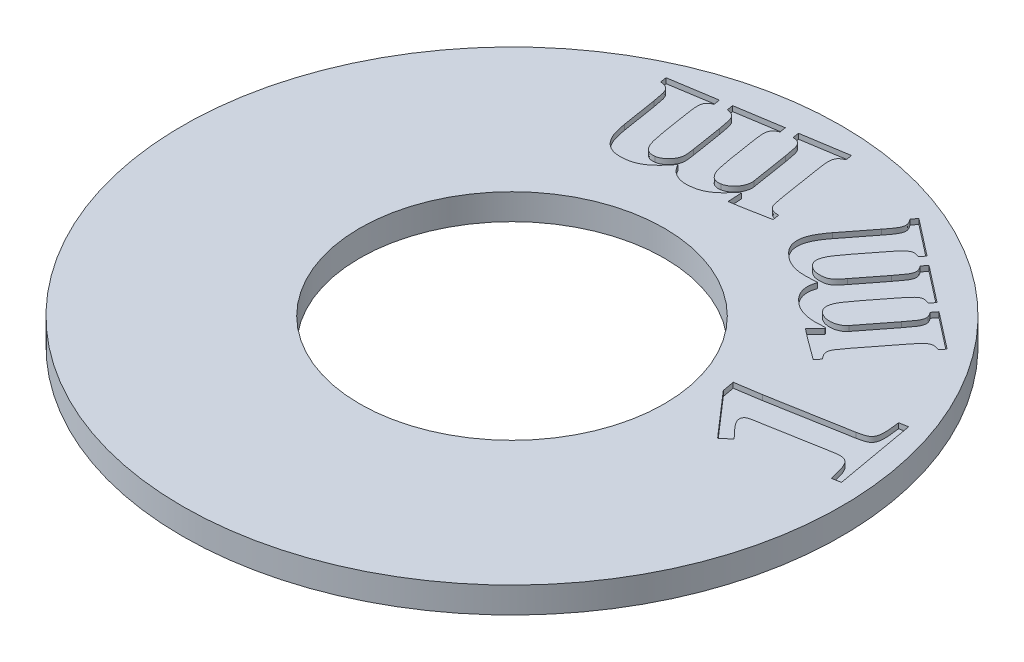
from build123d import *

# Parameters (mm, degrees)
SKETCH1_R           = 12.7
BOSS_EXTRUDE1_DEPTH = 1
SKETCH2_R           = 5.8674
CUT_EXTRUDE1_DEPTH  = 18.98832955
CUT_EXTRUDE2_DEPTH  = 0.2


with BuildPart() as part:
    # Sketch1 → Boss-Extrude1 (new body)
    with BuildSketch(Plane(origin=(0, 0, 0), x_dir=(1, 0, 0), z_dir=(0, 1, 0))):
        with Locations(Location((0, 0, 0), (0, 0, 270))):
            Circle(SKETCH1_R)
    extrude(amount=BOSS_EXTRUDE1_DEPTH)

    # Sketch2 → Cut-Extrude1 (cut, through all)
    with BuildSketch(Plane(origin=(0, 0, 0), x_dir=(-1, 0, 0), z_dir=(0, -1, 0))):
        with Locations(Location((0, 0, 0), (0, 0, 90))):
            Circle(SKETCH2_R)
    extrude(amount=-CUT_EXTRUDE1_DEPTH, mode=Mode.SUBTRACT)

    # Sketch4 → Cut-Extrude2 (cut)
    with BuildSketch(Plane(origin=(0, 1, 0), x_dir=(1, 0, 0), z_dir=(0, 1, 0))):
        with BuildLine():
            add(Edge.make_bspline(
                [(10.502835701, 2.747256944), (10.535958787, 2.753635056), (10.597619367, 2.765508288), (10.68289299, 2.785497337), (10.754934333, 2.804751749), (10.83115688, 2.831434792), (10.908616374, 2.872710013), (10.983063242, 2.939891348), (11.031547566, 3.030268528), (11.057288986, 3.142661226), (11.066935793, 3.278500029), (11.06128653, 3.408848056), (11.053268397, 3.529765111), (11.041774037, 3.63744486), (11.026137193, 3.758286119), (11.014089218, 3.843452977), (11.007748896, 3.888272569)],
                knots=[0, 0, 0, 0, 0.95120931, 1.770732274, 2.469728581, 3.053236218, 4.045778316, 4.92566005, 5.839669914, 6.887844203, 8.156461987, 9.670137205, 10.563586198, 11.574197932, 12.723406461, 14, 14, 14, 14], degree=3))
            Line((11.007748896, 3.888272569), (11.339580493, 3.947803819))
            Line((11.339580493, 3.947803819), (11.900717646, 0.795954861))
            Line((11.900717646, 0.795954861), (11.568886048, 0.736423611))
            add(Edge.make_bspline(
                [(11.568886048, 0.736423611), (11.554803043, 0.798585514), (11.528746521, 0.913598105), (11.489384912, 1.071011026), (11.453602851, 1.199155265), (11.419912183, 1.300799564), (11.386730997, 1.382540059), (11.35336047, 1.450924625), (11.316835265, 1.508004968), (11.277656715, 1.55458428), (11.234590877, 1.59165404), (11.187644786, 1.62258404), (11.134361285, 1.64406377), (11.074344364, 1.659243306), (11.003086635, 1.66500658), (10.917056963, 1.663740947), (10.814442972, 1.651454292), (10.740904843, 1.639267459), (10.701273201, 1.632699653)],
                knots=[0, 0, 0, 0, 2.063073641, 3.817120061, 5.251678484, 6.368851115, 7.281122152, 8.10565521, 8.828216282, 9.469439415, 10.068097664, 10.662010233, 11.280545861, 11.918117793, 12.659047895, 13.586927584, 14.699531502, 16, 16, 16, 16], degree=3))
            Line((10.701273201, 1.632699653), (8.060952021, 1.163064236))
            add(Edge.make_bspline(
                [(8.060952021, 1.163064236), (8.037667348, 1.158078091), (7.994477264, 1.148829432), (7.936130638, 1.128346498), (7.889333412, 1.101785371), (7.854520705, 1.069466258), (7.829800128, 1.032851206), (7.817133941, 0.991590699), (7.810708439, 0.947006345), (7.815062759, 0.916476287), (7.817314868, 0.900685764)],
                knots=[0, 0, 0, 0, 1.400993529, 2.598663486, 3.626413984, 4.544745121, 5.372764933, 6.19368933, 7.065753812, 8, 8, 8, 8], degree=3))
            add(Edge.make_bspline(
                [(7.817314868, 0.900685764), (7.821529308, 0.883943745), (7.830815176, 0.847055295), (7.859831933, 0.790796719), (7.896481283, 0.725393275), (7.938756081, 0.667449744), (7.979789109, 0.614975147), (8.018534287, 0.568769553), (8.063746687, 0.516951587), (8.115980512, 0.459628299), (8.174041538, 0.395714584), (8.239200773, 0.326359636), (8.310840637, 0.251371205), (8.361130158, 0.199858655), (8.387271465, 0.173081597)],
                knots=[0, 0, 0, 0, 0.664509197, 1.464143271, 2.430196891, 3.559892813, 4.226820614, 5.002434619, 5.887259823, 6.881648262, 7.996278507, 9.220784234, 10.555318662, 12, 12, 12, 12], degree=3))
            Line((8.387271465, 0.173081597), (8.04000584, -0.117960069))
            Line((8.04000584, -0.117960069), (6.557236743, 1.585295139))
            Line((6.557236743, 1.585295139), (6.473452021, 2.052725694))
            add(Edge.make_bspline(
                [(6.473452021, 2.052725694), (6.504325495, 2.056351962), (6.569060101, 2.063955416), (6.670587219, 2.076897917), (6.780259537, 2.094127133), (6.898350755, 2.111263083), (7.024355019, 2.131394976), (7.158854817, 2.153428708), (7.301825046, 2.177571224), (7.399872247, 2.194875437), (7.450205493, 2.203758681)],
                knots=[0, 0, 0, 0, 0.754743075, 1.582523401, 2.484708457, 3.449980394, 4.479693127, 5.582710837, 6.759066988, 8, 8, 8, 8], degree=3))
            Line((7.450205493, 2.203758681), (10.502835701, 2.747256944))
        make_face()
        with BuildLine():
            Line((6.446112276, 5.621046804), (6.418551512, 5.656324582))
            add(Edge.make_bspline(
                [(6.418551512, 5.656324582), (6.345103003, 5.650481726), (6.205690041, 5.639391375), (6.006049673, 5.640001619), (5.827169527, 5.650699674), (5.666856777, 5.67597167), (5.521469939, 5.714933464), (5.387561193, 5.768451828), (5.261579098, 5.83414063), (5.185430088, 5.889090651), (5.147449081, 5.916498193)],
                knots=[0, 0, 0, 0, 1.328700104, 2.522011983, 3.598465663, 4.558669638, 5.444794913, 6.307777922, 7.155966722, 8, 8, 8, 8], degree=3))
            add(Edge.make_bspline(
                [(5.147449081, 5.916498193), (5.113549109, 5.943897718), (5.048106477, 5.996791479), (4.961452983, 6.081290035), (4.888569595, 6.165417061), (4.830459206, 6.250285271), (4.784446219, 6.336029232), (4.750511209, 6.423590405), (4.725338541, 6.51279674), (4.712276312, 6.605066622), (4.710185373, 6.700889708), (4.719470407, 6.800614492), (4.739279008, 6.904788894), (4.760550248, 6.974274273), (4.771520262, 7.010109304)],
                knots=[0, 0, 0, 0, 1.254723853, 2.422197594, 3.480533536, 4.455073735, 5.378270259, 6.276377898, 7.154433995, 8.041941717, 8.952311201, 9.908521309, 10.921381655, 12, 12, 12, 12], degree=3))
            add(Edge.make_bspline(
                [(4.771520262, 7.010109304), (4.691090698, 7.003656459), (4.538471998, 6.991411896), (4.321666343, 6.98846259), (4.129911724, 6.995416816), (3.960718577, 7.018564153), (3.808601542, 7.056299759), (3.667745769, 7.110172456), (3.535147857, 7.17881181), (3.454567942, 7.236924978), (3.414428248, 7.265873193)],
                knots=[0, 0, 0, 0, 1.366310217, 2.59263486, 3.670585393, 4.613332156, 5.479848919, 6.319088227, 7.162678639, 8, 8, 8, 8], degree=3))
            add(Edge.make_bspline(
                [(3.414428248, 7.265873193), (3.3775521, 7.295803428), (3.306764809, 7.353257376), (3.21306857, 7.444735382), (3.134735925, 7.535260481), (3.072420666, 7.626680072), (3.027114725, 7.721083516), (2.993029681, 7.816985205), (2.9748084, 7.916670154), (2.967827049, 8.01881721), (2.974809687, 8.124007378), (2.995095498, 8.231959079), (3.028806982, 8.342103336), (3.074329878, 8.45600405), (3.135236882, 8.572567121), (3.206795227, 8.695687314), (3.293019282, 8.822881794), (3.357079528, 8.907680315), (3.390174776, 8.951489512)],
                knots=[0, 0, 0, 0, 1.169264857, 2.244515684, 3.220319539, 4.113963992, 4.959955291, 5.792870505, 6.612950669, 7.447388896, 8.308923635, 9.201834464, 10.146760853, 11.141726431, 12.218423767, 13.382633535, 14.647798067, 16, 16, 16, 16], degree=3))
            Line((3.390174776, 8.951489512), (4.221407414, 10.019744721))
            add(Edge.make_bspline(
                [(4.221407414, 10.019744721), (4.253451667, 10.061583607), (4.315528507, 10.14263483), (4.402700621, 10.258852189), (4.474099835, 10.363054012), (4.52285553, 10.455601314), (4.552580969, 10.535251364), (4.563466398, 10.608503251), (4.558254548, 10.679867299), (4.53147758, 10.75154504), (4.489681708, 10.826689156), (4.454202161, 10.876320457), (4.435278942, 10.902791596)],
                knots=[0, 0, 0, 0, 1.558183804, 3.018548385, 4.296309646, 5.28770402, 6.105589718, 6.797073249, 7.462098622, 8.197436721, 9.038592567, 10, 10, 10, 10], degree=3))
            Line((4.435278942, 10.902791596), (4.585209498, 11.095716943))
            Line((4.585209498, 11.095716943), (5.996320609, 9.99769611))
            Line((5.996320609, 9.99769611), (5.846390053, 9.804770762))
            add(Edge.make_bspline(
                [(5.846390053, 9.804770762), (5.821598554, 9.814853431), (5.775331585, 9.833670142), (5.707363836, 9.85237221), (5.646143658, 9.858436215), (5.590929353, 9.853196728), (5.540343575, 9.836119226), (5.490007513, 9.81172786), (5.439948532, 9.776609976), (5.384915117, 9.732987716), (5.324969903, 9.670799848), (5.252764521, 9.589061458), (5.16514284, 9.485038198), (5.10380747, 9.40664927), (5.070278942, 9.36379854)],
                knots=[0, 0, 0, 0, 0.974495288, 1.818645247, 2.55789592, 3.203887047, 3.821953837, 4.492443581, 5.234959137, 6.043992897, 7.047297203, 8.374577793, 10.01818969, 12, 12, 12, 12], degree=3))
            Line((5.070278942, 9.36379854), (4.459532414, 8.578867985))
            add(Edge.make_bspline(
                [(4.459532414, 8.578867985), (4.427040039, 8.536727017), (4.36533113, 8.456693682), (4.279860313, 8.340926267), (4.207480509, 8.23488918), (4.144743666, 8.140152652), (4.093939387, 8.053261371), (4.055224804, 7.972382939), (4.025674683, 7.897486598), (4.007618905, 7.827463577), (3.999758774, 7.762907557), (3.999966382, 7.703395202), (4.005428339, 7.648104338), (4.021722039, 7.597238119), (4.045740851, 7.549179791), (4.078974228, 7.503189368), (4.121883321, 7.458704343), (4.154616135, 7.431294161), (4.171798039, 7.416906179)],
                knots=[0, 0, 0, 0, 1.888953508, 3.587465034, 5.107152686, 6.445866775, 7.620537267, 8.676590056, 9.626254862, 10.474157069, 11.23623705, 11.927603465, 12.58451522, 13.199276758, 13.811819934, 14.485105834, 15.204811187, 16, 16, 16, 16], degree=3))
            add(Edge.make_bspline(
                [(4.171798039, 7.416906179), (4.196907921, 7.398623115), (4.24575502, 7.363056452), (4.329546375, 7.32690278), (4.419900083, 7.306286873), (4.515987475, 7.298075567), (4.611843152, 7.301326536), (4.703352488, 7.308761322), (4.788476175, 7.328417137), (4.868537558, 7.362467429), (4.944132959, 7.410449543), (5.003782637, 7.463505766), (5.054181963, 7.517595359), (5.101176163, 7.571027473), (5.155289779, 7.638105142), (5.193805445, 7.686959904), (5.214697345, 7.713459999)],
                knots=[0, 0, 0, 0, 1.060451807, 2.062932707, 3.097103212, 4.220994073, 5.353228603, 6.376944908, 7.359261765, 8.328691766, 9.340596163, 10.410182602, 11.05076008, 11.870698325, 12.845011315, 14, 14, 14, 14], degree=3))
            Line((5.214697345, 7.713459999), (5.957735539, 8.66816486))
            add(Edge.make_bspline(
                [(5.957735539, 8.66816486), (5.982092993, 8.699319813), (6.027952625, 8.757977615), (6.090423825, 8.841053313), (6.142342187, 8.913544593), (6.197870379, 8.990195), (6.249297759, 9.073408186), (6.29114706, 9.165636672), (6.310604917, 9.252795431), (6.30324831, 9.324426645), (6.285186466, 9.381667531), (6.264023921, 9.429739499), (6.232698883, 9.48084353), (6.207857504, 9.515367573), (6.194758109, 9.533572846)],
                knots=[0, 0, 0, 0, 1.428852229, 2.69020885, 3.755221618, 4.650440021, 6.110052653, 7.281631402, 8.297160143, 9.297295893, 9.839073942, 10.463254767, 11.189641066, 12, 12, 12, 12], degree=3))
            Line((6.194758109, 9.533572846), (6.344688664, 9.726498193))
            Line((6.344688664, 9.726498193), (7.739263317, 8.640604096))
            Line((7.739263317, 8.640604096), (7.589332762, 8.447678749))
            add(Edge.make_bspline(
                [(7.589332762, 8.447678749), (7.564184317, 8.458169169), (7.516888214, 8.477898261), (7.447738497, 8.497032573), (7.385486432, 8.504959726), (7.329450384, 8.499379022), (7.278376194, 8.482329334), (7.227319552, 8.459564119), (7.178554253, 8.423744301), (7.124521011, 8.380289164), (7.065790511, 8.31767881), (6.99307334, 8.236382683), (6.90602346, 8.130825514), (6.84391499, 8.052041093), (6.809914359, 8.008911387)],
                knots=[0, 0, 0, 0, 0.986342731, 1.854992093, 2.591493093, 3.247165752, 3.874524497, 4.535580437, 5.263002682, 6.057269968, 7.045676649, 8.365642244, 10.010408946, 12, 12, 12, 12], degree=3))
            Line((6.809914359, 8.008911387), (6.199167831, 7.223980832))
            add(Edge.make_bspline(
                [(6.199167831, 7.223980832), (6.1751448, 7.193217202), (6.128820384, 7.133894666), (6.064470667, 7.047003547), (6.005667413, 6.967536238), (5.953399564, 6.894695326), (5.908577343, 6.827540339), (5.869029665, 6.766708727), (5.837481339, 6.710333021), (5.802625077, 6.644943933), (5.770963015, 6.567952334), (5.744339164, 6.480543218), (5.734321689, 6.398573054), (5.736407268, 6.323235217), (5.755317287, 6.253747629), (5.786992728, 6.186877603), (5.838949571, 6.122592111), (5.883831274, 6.085438123), (5.908126164, 6.065326318)],
                knots=[0, 0, 0, 0, 1.387103131, 2.674797394, 3.842386028, 4.900548409, 5.86041802, 6.711809731, 7.478006622, 8.155605191, 9.344042684, 10.43114453, 11.391724629, 12.267604767, 13.091197959, 13.932310922, 14.880740337, 16, 16, 16, 16], degree=3))
            add(Edge.make_bspline(
                [(5.908126164, 6.065326318), (5.92724958, 6.05188526), (5.966036324, 6.024623661), (6.032692056, 5.993550347), (6.107049239, 5.971043667), (6.187819264, 5.954527731), (6.272883487, 5.946510823), (6.359519721, 5.950174322), (6.446294721, 5.963823989), (6.53258789, 5.986026651), (6.614596751, 6.020389001), (6.690833791, 6.063035119), (6.757619821, 6.117520035), (6.794712531, 6.160658186), (6.813221651, 6.182183957)],
                knots=[0, 0, 0, 0, 0.841485411, 1.706728545, 2.636983739, 3.637338779, 4.674903333, 5.709078804, 6.7546484, 7.837656936, 8.912857559, 9.95143668, 10.977774795, 12, 12, 12, 12], degree=3))
            Line((6.813221651, 6.182183957), (7.695166095, 7.315482568))
            add(Edge.make_bspline(
                [(7.695166095, 7.315482568), (7.728014018, 7.358000395), (7.788496594, 7.436288075), (7.869304066, 7.544976045), (7.931241751, 7.634991871), (7.976730187, 7.708273557), (8.008966806, 7.771056115), (8.029709996, 7.829288183), (8.042924298, 7.885143031), (8.045069208, 7.940051692), (8.037490603, 7.996136863), (8.014924563, 8.054405487), (7.980117392, 8.116225886), (7.950303267, 8.156952636), (7.934393526, 8.178685693)],
                knots=[0, 0, 0, 0, 1.946253878, 3.583619155, 4.90541557, 5.903065839, 6.706730513, 7.456203084, 8.137693296, 8.777198399, 9.436082692, 10.17303834, 11.025076595, 12, 12, 12, 12], degree=3))
            Line((7.934393526, 8.178685693), (8.084324081, 8.37161104))
            Line((8.084324081, 8.37161104), (9.487718178, 7.27910236))
            Line((9.487718178, 7.27910236), (9.337787623, 7.086177012))
            add(Edge.make_bspline(
                [(9.337787623, 7.086177012), (9.310775429, 7.0966318), (9.260723911, 7.116003717), (9.187673864, 7.135537847), (9.123019149, 7.144452452), (9.064830325, 7.140087962), (9.012522306, 7.124265196), (8.960801373, 7.102391813), (8.910212078, 7.069482703), (8.856472687, 7.026121446), (8.796761068, 6.965984534), (8.724427609, 6.885322286), (8.638553239, 6.78089514), (8.576615815, 6.702998059), (8.542935192, 6.660638818)],
                knots=[0, 0, 0, 0, 1.0399122, 1.926877353, 2.71123319, 3.373420874, 4.004478301, 4.666665984, 5.384545304, 6.163885671, 7.144097132, 8.424650005, 10.055779381, 12, 12, 12, 12], degree=3))
            Line((8.542935192, 6.660638818), (7.60586922, 5.456784651))
            add(Edge.make_bspline(
                [(7.60586922, 5.456784651), (7.579695927, 5.423041412), (7.531000421, 5.360261992), (7.464615767, 5.272214489), (7.410772827, 5.196862452), (7.35505243, 5.118965683), (7.3062141, 5.034369264), (7.266301268, 4.941020505), (7.257033, 4.850826575), (7.268994039, 4.777697278), (7.294307526, 4.717385158), (7.326608903, 4.665864149), (7.367927347, 4.606464412), (7.401556879, 4.566478611), (7.419558456, 4.545074582)],
                knots=[0, 0, 0, 0, 1.450639645, 2.698920323, 3.745170182, 4.597024574, 5.950243738, 7.060652374, 8.014587129, 8.989365666, 9.543411076, 10.226324432, 11.050567859, 12, 12, 12, 12], degree=3))
            Line((7.419558456, 4.545074582), (7.264115748, 4.345534651))
            Line((7.264115748, 4.345534651), (6.442804984, 4.947461735))
            Line((6.442804984, 4.947461735), (6.074593178, 5.234093679))
            Line((6.074593178, 5.234093679), (6.446112276, 5.621046804))
        make_face()
        with BuildLine():
            Line((0.313853362, 8.525956305), (0.266448848, 8.530366027))
            add(Edge.make_bspline(
                [(0.266448848, 8.530366027), (0.220587801, 8.472712263), (0.133110419, 8.362740934), (-0.004365315, 8.216579062), (-0.134419634, 8.091399905), (-0.26345541, 7.991600635), (-0.391287899, 7.911021784), (-0.522521219, 7.849326117), (-0.657183893, 7.801559088), (-0.750062007, 7.783960964), (-0.796294208, 7.775201097)],
                knots=[0, 0, 0, 0, 1.321709555, 2.521087024, 3.598960819, 4.558109064, 5.44394598, 6.305457593, 7.156502851, 8, 8, 8, 8], degree=3))
            add(Edge.make_bspline(
                [(-0.796294208, 7.775201097), (-0.839944877, 7.768960851), (-0.923669459, 7.756991687), (-1.045452622, 7.751329453), (-1.157309896, 7.756606178), (-1.259753383, 7.771731323), (-1.354164127, 7.797300062), (-1.441453203, 7.833576517), (-1.52489044, 7.87569231), (-1.601582422, 7.92961482), (-1.673310621, 7.993632909), (-1.739982334, 8.068486542), (-1.802626549, 8.154631273), (-1.839037783, 8.217645133), (-1.857934833, 8.250348666)],
                knots=[0, 0, 0, 0, 1.262383675, 2.421327046, 3.485651979, 4.465097507, 5.381738202, 6.278834679, 7.168553644, 8.05321575, 8.955237983, 9.91670527, 10.918791849, 12, 12, 12, 12], degree=3))
            add(Edge.make_bspline(
                [(-1.857934833, 8.250348666), (-1.90877596, 8.187008607), (-2.00522163, 8.066852448), (-2.151117808, 7.90429903), (-2.290041501, 7.770169918), (-2.42237, 7.660920578), (-2.554191293, 7.574649228), (-2.690177048, 7.508178238), (-2.831656224, 7.457141582), (-2.929902909, 7.438416019), (-2.979106708, 7.429037902)],
                knots=[0, 0, 0, 0, 1.367019779, 2.593237953, 3.673809289, 4.614754209, 5.477752088, 6.31872209, 7.157984213, 8, 8, 8, 8], degree=3))
            add(Edge.make_bspline(
                [(-2.979106708, 7.429037902), (-3.026059084, 7.422313077), (-3.116363637, 7.40937907), (-3.247369376, 7.404275703), (-3.367795645, 7.408861262), (-3.477868354, 7.42618411), (-3.579049507, 7.456379764), (-3.672210418, 7.498761458), (-3.759200344, 7.552032666), (-3.839177412, 7.617470965), (-3.910830954, 7.695734725), (-3.976479508, 7.784665243), (-4.034537182, 7.885532337), (-4.086457137, 7.997681719), (-4.132118696, 8.122243067), (-4.168735586, 8.260041405), (-4.205840999, 8.409494464), (-4.222701413, 8.514404278), (-4.231467819, 8.568951097)],
                knots=[0, 0, 0, 0, 1.161439086, 2.233821674, 3.207260032, 4.110189863, 4.956199937, 5.786297692, 6.610908432, 7.449024294, 8.309099073, 9.204093284, 10.152261841, 11.155272774, 12.229128442, 13.397873342, 14.647050006, 16, 16, 16, 16], degree=3))
            Line((-4.231467819, 8.568951097), (-4.445339347, 9.915018805))
            add(Edge.make_bspline(
                [(-4.445339347, 9.915018805), (-4.453968854, 9.967233872), (-4.470648589, 10.068158929), (-4.49743887, 10.211380795), (-4.524685526, 10.335077023), (-4.557401262, 10.434852747), (-4.596893377, 10.510944501), (-4.643015377, 10.569856606), (-4.700587884, 10.614839055), (-4.771670566, 10.64401948), (-4.854978101, 10.666808477), (-4.91554102, 10.67330914), (-4.94804768, 10.676798319)],
                knots=[0, 0, 0, 0, 1.556776784, 3.009050718, 4.285993182, 5.280798359, 6.088364277, 6.795732101, 7.466033526, 8.211290206, 9.039924425, 10, 10, 10, 10], degree=3))
            Line((-4.94804768, 10.676798319), (-4.986632749, 10.920435472))
            Line((-4.986632749, 10.920435472), (-3.209514694, 11.202657694))
            Line((-3.209514694, 11.202657694), (-3.170929624, 10.959020541))
            add(Edge.make_bspline(
                [(-3.170929624, 10.959020541), (-3.1955222, 10.948274173), (-3.241636376, 10.928123379), (-3.301383001, 10.890257762), (-3.349616556, 10.851198802), (-3.382533123, 10.806155645), (-3.405703355, 10.757404121), (-3.419878086, 10.703054317), (-3.431779295, 10.642767853), (-3.435574724, 10.57245081), (-3.432618312, 10.485524547), (-3.422064489, 10.375927445), (-3.403820359, 10.240039117), (-3.388657088, 10.140990442), (-3.38039143, 10.086997972)],
                knots=[0, 0, 0, 0, 0.969779354, 1.818458417, 2.554157673, 3.20052523, 3.8192083, 4.496967745, 5.227358508, 6.040378365, 7.038205311, 8.373543936, 10.023180803, 12, 12, 12, 12], degree=3))
            Line((-3.38039143, 10.086997972), (-3.223846291, 9.099220194))
            add(Edge.make_bspline(
                [(-3.223846291, 9.099220194), (-3.215227763, 9.046636467), (-3.198810146, 8.946468614), (-3.172292417, 8.804233798), (-3.146374998, 8.677591368), (-3.119216219, 8.56625168), (-3.088752441, 8.469337514), (-3.058340166, 8.383915324), (-3.020988556, 8.311907887), (-2.983052645, 8.250047646), (-2.9403307, 8.200299225), (-2.896928005, 8.158691062), (-2.852193168, 8.125100637), (-2.803967184, 8.101198407), (-2.752634363, 8.085140565), (-2.695940612, 8.079901249), (-2.634163691, 8.077597969), (-2.591377829, 8.083895558), (-2.569002541, 8.087188944)],
                knots=[0, 0, 0, 0, 1.879302477, 3.579923031, 5.102516498, 6.43847557, 7.619109878, 8.685516954, 9.630316028, 10.475250734, 11.238613256, 11.935364263, 12.593814088, 13.202415535, 13.825608582, 14.478293096, 15.204208384, 16, 16, 16, 16], degree=3))
            add(Edge.make_bspline(
                [(-2.569002541, 8.087188944), (-2.538163079, 8.093382104), (-2.478532253, 8.105357128), (-2.394656651, 8.14283353), (-2.317494931, 8.195021488), (-2.24573651, 8.260419012), (-2.181107746, 8.332153066), (-2.123831091, 8.404596344), (-2.079289987, 8.480367808), (-2.050670586, 8.56285552), (-2.034279614, 8.650879435), (-2.03038681, 8.730698931), (-2.035644191, 8.804578121), (-2.042089163, 8.876314479), (-2.053342192, 8.963059354), (-2.063191476, 9.025749928), (-2.068499069, 9.059532694)],
                knots=[0, 0, 0, 0, 1.066239177, 2.061667717, 3.097334799, 4.220563205, 5.352161382, 6.376319012, 7.355316561, 8.323097728, 9.327340028, 10.390062672, 11.0280924, 11.843315407, 12.837803384, 14, 14, 14, 14], degree=3))
            Line((-2.068499069, 9.059532694), (-2.259219555, 10.261182))
            add(Edge.make_bspline(
                [(-2.259219555, 10.261182), (-2.265189068, 10.300550507), (-2.276367674, 10.374272601), (-2.296122881, 10.476856372), (-2.311449485, 10.565092055), (-2.333244723, 10.658190139), (-2.357413956, 10.753633086), (-2.397599585, 10.847457095), (-2.4488931, 10.920993429), (-2.506101212, 10.965507213), (-2.560536594, 10.991486992), (-2.609969791, 11.008449388), (-2.668336298, 11.019413766), (-2.710093776, 11.025341112), (-2.732162263, 11.028473666)],
                knots=[0, 0, 0, 0, 1.433434736, 2.68427268, 3.761168802, 4.656659373, 6.126928261, 7.29968854, 8.313279962, 9.321676997, 9.866066009, 10.48111294, 11.19728056, 12, 12, 12, 12], degree=3))
            Line((-2.732162263, 11.028473666), (-2.770747333, 11.272110819))
            Line((-2.770747333, 11.272110819), (-1.016780319, 11.549923319))
            Line((-1.016780319, 11.549923319), (-0.978195249, 11.306286166))
            add(Edge.make_bspline(
                [(-0.978195249, 11.306286166), (-1.003539507, 11.295588296), (-1.05081222, 11.275634372), (-1.111895494, 11.237496403), (-1.161160656, 11.198478729), (-1.195529293, 11.153275612), (-1.219332957, 11.104376677), (-1.233858811, 11.049994325), (-1.245845766, 10.990428501), (-1.248131032, 10.920389717), (-1.244252884, 10.834232839), (-1.232099021, 10.724754883), (-1.214563153, 10.58839066), (-1.199286672, 10.488617856), (-1.190964347, 10.434263597)],
                knots=[0, 0, 0, 0, 0.989028705, 1.844759954, 2.586937196, 3.238107674, 3.871415783, 4.533125195, 5.259921945, 6.054965184, 7.048323037, 8.365174644, 10.01981869, 12, 12, 12, 12], degree=3))
            Line((-1.190964347, 10.434263597), (-1.034419208, 9.446485819))
            add(Edge.make_bspline(
                [(-1.034419208, 9.446485819), (-1.028284705, 9.407515179), (-1.016522902, 9.332796012), (-0.997794986, 9.225472348), (-0.978788568, 9.127843148), (-0.957118142, 9.015092544), (-0.92713746, 8.896731465), (-0.890202667, 8.776099361), (-0.846829242, 8.680304169), (-0.799827341, 8.60076994), (-0.746857119, 8.537114013), (-0.691097612, 8.485253813), (-0.626591832, 8.452528987), (-0.556339665, 8.428456815), (-0.472992748, 8.422934964), (-0.414757912, 8.430379669), (-0.382882749, 8.434454569)],
                knots=[0, 0, 0, 0, 1.217997893, 2.335291105, 3.363301837, 4.288921831, 5.879406356, 7.131588601, 8.17759787, 9.119347984, 9.973511448, 10.729163452, 11.449941662, 12.189059626, 13.008771681, 14, 14, 14, 14], degree=3))
            add(Edge.make_bspline(
                [(-0.382882749, 8.434454569), (-0.359875434, 8.438812656), (-0.312670065, 8.447754381), (-0.244525142, 8.476737934), (-0.176304789, 8.514964956), (-0.108641116, 8.562544432), (-0.045650694, 8.620933806), (0.012522922, 8.686043096), (0.061956884, 8.7593599), (0.103685428, 8.838283335), (0.136408142, 8.921606199), (0.154309625, 9.007588437), (0.162701488, 9.094558661), (0.155463208, 9.151799875), (0.15179607, 9.180800055)],
                knots=[0, 0, 0, 0, 0.835871289, 1.715002913, 2.633388593, 3.633187471, 4.666417129, 5.700650574, 6.751143417, 7.821774814, 8.891517419, 9.941351542, 10.95702464, 12, 12, 12, 12], degree=3))
            Line((0.15179607, 9.180800055), (-0.074202194, 10.607345194))
            add(Edge.make_bspline(
                [(-0.074202194, 10.607345194), (-0.0827033, 10.660686047), (-0.098328527, 10.758727753), (-0.124174258, 10.892356055), (-0.146107794, 11.000081328), (-0.168777011, 11.084461368), (-0.192328462, 11.151581226), (-0.219827574, 11.207320309), (-0.252192214, 11.254760428), (-0.290360467, 11.294727515), (-0.337845169, 11.326906546), (-0.395953257, 11.350746254), (-0.4656423, 11.366694908), (-0.515833552, 11.372583246), (-0.54273518, 11.375739291)],
                knots=[0, 0, 0, 0, 1.944391131, 3.573835333, 4.89976862, 5.901119108, 6.717182758, 7.456739864, 8.131968056, 8.777512876, 9.434346179, 10.181320822, 11.025219969, 12, 12, 12, 12], degree=3))
            Line((-0.54273518, 11.375739291), (-0.581320249, 11.619376444))
            Line((-0.581320249, 11.619376444), (1.18367107, 11.898291375))
            Line((1.18367107, 11.898291375), (1.22225614, 11.654654222))
            add(Edge.make_bspline(
                [(1.22225614, 11.654654222), (1.19625358, 11.642320887), (1.14785195, 11.619363395), (1.083956718, 11.579411666), (1.033199809, 11.537997656), (0.996115313, 11.492400193), (0.971907979, 11.442441633), (0.952327319, 11.389471255), (0.942318303, 11.329790665), (0.936003298, 11.261211079), (0.939860158, 11.175976409), (0.950170447, 11.067904886), (0.968541079, 10.933108835), (0.983606087, 10.834419647), (0.991848153, 10.780426791)],
                knots=[0, 0, 0, 0, 1.029437697, 1.916213766, 2.690941621, 3.364738409, 4.000075764, 4.6698806, 5.379325844, 6.158174325, 7.131901521, 8.426385959, 10.044875728, 12, 12, 12, 12], degree=3))
            Line((0.991848153, 10.780426791), (1.231075584, 9.265687208))
            add(Edge.make_bspline(
                [(1.231075584, 9.265687208), (1.237812541, 9.223017488), (1.250316557, 9.14382107), (1.271234809, 9.034259492), (1.286790608, 8.942078167), (1.306037446, 8.847585285), (1.33297969, 8.753531648), (1.375000791, 8.660340036), (1.434691793, 8.591618497), (1.496545931, 8.549250257), (1.558872086, 8.528494985), (1.618128233, 8.514144363), (1.690939166, 8.504851265), (1.743684451, 8.501383727), (1.772368987, 8.499497972)],
                knots=[0, 0, 0, 0, 1.45510247, 2.700718576, 3.757006257, 4.604314627, 5.947710583, 7.049444465, 8.014850273, 8.979620945, 9.531703584, 10.219269411, 11.031582988, 12, 12, 12, 12], degree=3))
            Line((1.772368987, 8.499497972), (1.812056487, 8.249246236))
            Line((1.812056487, 8.249246236), (0.80663982, 8.05962818))
            Line((0.80663982, 8.05962818), (0.341414126, 7.985765333))
            Line((0.341414126, 7.985765333), (0.313853362, 8.525956305))
        make_face()
    extrude(amount=-CUT_EXTRUDE2_DEPTH, mode=Mode.SUBTRACT)


solid = part.part
